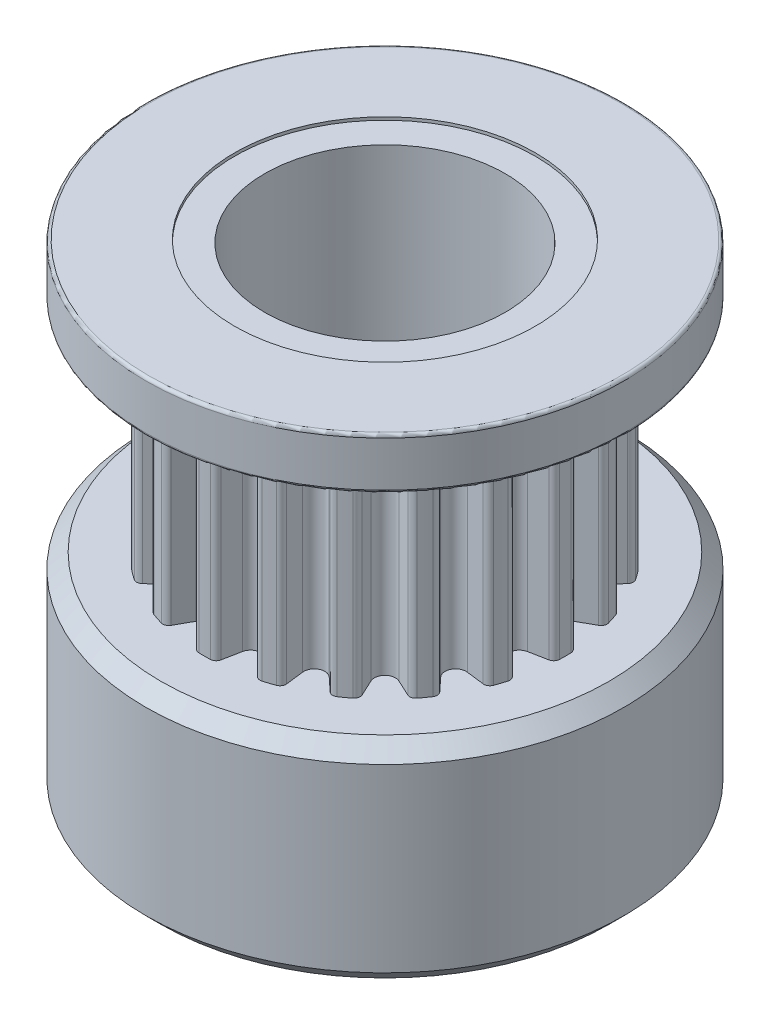
from build123d import *

# Parameters (mm, degrees)
SKETCH1_R           = 7.95
BOSS_EXTRUDE1_DEPTH = 7
BOSS_EXTRUDE2_DEPTH = 7.3
SKETCH3_R           = 7.95
BOSS_EXTRUDE3_DEPTH = 1.7
SKETCH4_R           = 4
CUT_EXTRUDE1_DEPTH  = 20.555178342
SKETCH5_R           = 5
CUT_EXTRUDE2_DEPTH  = 0.1
SKETCH6_R           = 1.65
CUT_EXTRUDE3_DEPTH  = 20.555178342
FILLET1_R           = 0.1
CHAMFER1_SIZE       = 0.5


with BuildPart() as part:
    # Sketch1 → Boss-Extrude1 (new body)
    with BuildSketch(Plane(origin=(0, 0, 0), x_dir=(1, 0, 0), z_dir=(0, 1, 0))):
        with Locations(Location((0, 0, 0), (0, 0, 270))):
            Circle(SKETCH1_R)
    extrude(amount=BOSS_EXTRUDE1_DEPTH)

    # Sketch2 → Boss-Extrude2 (add)
    with BuildSketch(Plane(origin=(0, 7, 0), x_dir=(1, 0, 0), z_dir=(0, 1, 0))):
        with BuildLine():
            Line((-0.380236117, 5.835559868), (-0.497075688, 5.239605014))
            ThreePointArc((-0.497075688, 5.239605014), (-0.785784996, 4.961251208), (-1.146379921, 5.136765327))
            Line((-1.146379921, 5.136765327), (-1.441661134, 5.667446661))
            ThreePointArc((-1.441661134, 5.667446661), (-1.540334972, 5.755161628), (-1.672167397, 5.762278733))
            ThreePointArc((-1.672167397, 5.762278733), (-1.854101966, 5.706339098), (-2.034170617, 5.644656757))
            ThreePointArc((-2.034170617, 5.644656757), (-2.136641961, 5.561409742), (-2.164913208, 5.432447817))
            Line((-2.164913208, 5.432447817), (-2.091874065, 4.829555657))
            ThreePointArc((-2.091874065, 4.829555657), (-2.280436877, 4.475609373), (-2.677619876, 4.531103259))
            Line((-2.677619876, 4.531103259), (-3.122438549, 4.944564287))
            ThreePointArc((-3.122438549, 4.944564287), (-3.24338836, 4.997494286), (-3.370967754, 4.963524594))
            ThreePointArc((-3.370967754, 4.963524594), (-3.526711514, 4.854101966), (-3.678906086, 4.739794301))
            ThreePointArc((-3.678906086, 4.739794301), (-3.750637383, 4.628956299), (-3.73767351, 4.497569923))
            Line((-3.73767351, 4.497569923), (-3.481905234, 3.946755742))
            ThreePointArc((-3.481905234, 3.946755742), (-3.551863708, 3.551863708), (-3.946755742, 3.481905234))
            Line((-3.946755742, 3.481905234), (-4.497569923, 3.73767351))
            ThreePointArc((-4.497569923, 3.73767351), (-4.628956299, 3.750637383), (-4.739794301, 3.678906086))
            ThreePointArc((-4.739794301, 3.678906086), (-4.854101966, 3.526711514), (-4.963524594, 3.370967754))
            ThreePointArc((-4.963524594, 3.370967754), (-4.997494286, 3.24338836), (-4.944564287, 3.122438549))
            Line((-4.944564287, 3.122438549), (-4.531103259, 2.677619876))
            ThreePointArc((-4.531103259, 2.677619876), (-4.475609373, 2.280436877), (-4.829555657, 2.091874065))
            Line((-4.829555657, 2.091874065), (-5.432447817, 2.164913208))
            ThreePointArc((-5.432447817, 2.164913208), (-5.561409742, 2.136641961), (-5.644656757, 2.034170617))
            ThreePointArc((-5.644656757, 2.034170617), (-5.706339098, 1.854101966), (-5.762278733, 1.672167397))
            ThreePointArc((-5.762278733, 1.672167397), (-5.755161628, 1.540334972), (-5.667446661, 1.441661134))
            Line((-5.667446661, 1.441661134), (-5.136765327, 1.146379921))
            ThreePointArc((-5.136765327, 1.146379921), (-4.961251208, 0.785784996), (-5.239605014, 0.497075688))
            Line((-5.239605014, 0.497075688), (-5.835559868, 0.380236117))
            ThreePointArc((-5.835559868, 0.380236117), (-5.949473652, 0.313497136), (-5.996980881, 0.190316355))
            ThreePointArc((-5.996980881, 0.190316355), (-6, 0), (-5.996980881, -0.190316355))
            ThreePointArc((-5.996980881, -0.190316355), (-5.949473652, -0.313497136), (-5.835559868, -0.380236117))
            Line((-5.835559868, -0.380236117), (-5.239605014, -0.497075688))
            ThreePointArc((-5.239605014, -0.497075688), (-4.961251208, -0.785784996), (-5.136765327, -1.146379921))
            Line((-5.136765327, -1.146379921), (-5.667446661, -1.441661134))
            ThreePointArc((-5.667446661, -1.441661134), (-5.755161628, -1.540334972), (-5.762278733, -1.672167397))
            ThreePointArc((-5.762278733, -1.672167397), (-5.706339098, -1.854101966), (-5.644656757, -2.034170617))
            ThreePointArc((-5.644656757, -2.034170617), (-5.561409742, -2.136641961), (-5.432447817, -2.164913208))
            Line((-5.432447817, -2.164913208), (-4.829555657, -2.091874065))
            ThreePointArc((-4.829555657, -2.091874065), (-4.475609373, -2.280436877), (-4.531103259, -2.677619876))
            Line((-4.531103259, -2.677619876), (-4.944564287, -3.122438549))
            ThreePointArc((-4.944564287, -3.122438549), (-4.997494286, -3.24338836), (-4.963524594, -3.370967754))
            ThreePointArc((-4.963524594, -3.370967754), (-4.854101966, -3.526711514), (-4.739794301, -3.678906086))
            ThreePointArc((-4.739794301, -3.678906086), (-4.628956299, -3.750637383), (-4.497569923, -3.73767351))
            Line((-4.497569923, -3.73767351), (-3.946755742, -3.481905234))
            ThreePointArc((-3.946755742, -3.481905234), (-3.551863708, -3.551863708), (-3.481905234, -3.946755742))
            Line((-3.481905234, -3.946755742), (-3.73767351, -4.497569923))
            ThreePointArc((-3.73767351, -4.497569923), (-3.750637383, -4.628956299), (-3.678906086, -4.739794301))
            ThreePointArc((-3.678906086, -4.739794301), (-3.526711514, -4.854101966), (-3.370967754, -4.963524594))
            ThreePointArc((-3.370967754, -4.963524594), (-3.24338836, -4.997494286), (-3.122438549, -4.944564287))
            Line((-3.122438549, -4.944564287), (-2.677619876, -4.531103259))
            ThreePointArc((-2.677619876, -4.531103259), (-2.280436877, -4.475609373), (-2.091874065, -4.829555657))
            Line((-2.091874065, -4.829555657), (-2.164913208, -5.432447817))
            ThreePointArc((-2.164913208, -5.432447817), (-2.136641961, -5.561409742), (-2.034170617, -5.644656757))
            ThreePointArc((-2.034170617, -5.644656757), (-1.854101966, -5.706339098), (-1.672167397, -5.762278733))
            ThreePointArc((-1.672167397, -5.762278733), (-1.540334972, -5.755161628), (-1.441661134, -5.667446661))
            Line((-1.441661134, -5.667446661), (-1.146379921, -5.136765327))
            ThreePointArc((-1.146379921, -5.136765327), (-0.785784996, -4.961251208), (-0.497075688, -5.239605014))
            Line((-0.497075688, -5.239605014), (-0.380236117, -5.835559868))
            ThreePointArc((-0.380236117, -5.835559868), (-0.313497136, -5.949473652), (-0.190316355, -5.996980881))
            ThreePointArc((-0.190316355, -5.996980881), (0, -6), (0.190316355, -5.996980881))
            ThreePointArc((0.190316355, -5.996980881), (0.313497136, -5.949473652), (0.380236117, -5.835559868))
            Line((0.380236117, -5.835559868), (0.497075688, -5.239605014))
            ThreePointArc((0.497075688, -5.239605014), (0.785784996, -4.961251208), (1.146379921, -5.136765327))
            Line((1.146379921, -5.136765327), (1.441661134, -5.667446661))
            ThreePointArc((1.441661134, -5.667446661), (1.540334972, -5.755161628), (1.672167397, -5.762278733))
            ThreePointArc((1.672167397, -5.762278733), (1.854101966, -5.706339098), (2.034170617, -5.644656757))
            ThreePointArc((2.034170617, -5.644656757), (2.136641961, -5.561409742), (2.164913208, -5.432447817))
            Line((2.164913208, -5.432447817), (2.091874065, -4.829555657))
            ThreePointArc((2.091874065, -4.829555657), (2.280436877, -4.475609373), (2.677619876, -4.531103259))
            Line((2.677619876, -4.531103259), (3.122438549, -4.944564287))
            ThreePointArc((3.122438549, -4.944564287), (3.24338836, -4.997494286), (3.370967754, -4.963524594))
            ThreePointArc((3.370967754, -4.963524594), (3.526711514, -4.854101966), (3.678906086, -4.739794301))
            ThreePointArc((3.678906086, -4.739794301), (3.750637383, -4.628956299), (3.73767351, -4.497569923))
            Line((3.73767351, -4.497569923), (3.481905234, -3.946755742))
            ThreePointArc((3.481905234, -3.946755742), (3.551863708, -3.551863708), (3.946755742, -3.481905234))
            Line((3.946755742, -3.481905234), (4.497569923, -3.73767351))
            ThreePointArc((4.497569923, -3.73767351), (4.628956299, -3.750637383), (4.739794301, -3.678906086))
            ThreePointArc((4.739794301, -3.678906086), (4.854101966, -3.526711514), (4.963524594, -3.370967754))
            ThreePointArc((4.963524594, -3.370967754), (4.997494286, -3.24338836), (4.944564287, -3.122438549))
            Line((4.944564287, -3.122438549), (4.531103259, -2.677619876))
            ThreePointArc((4.531103259, -2.677619876), (4.475609373, -2.280436877), (4.829555657, -2.091874065))
            Line((4.829555657, -2.091874065), (5.432447817, -2.164913208))
            ThreePointArc((5.432447817, -2.164913208), (5.561409742, -2.136641961), (5.644656757, -2.034170617))
            ThreePointArc((5.644656757, -2.034170617), (5.706339098, -1.854101966), (5.762278733, -1.672167397))
            ThreePointArc((5.762278733, -1.672167397), (5.755161628, -1.540334972), (5.667446661, -1.441661134))
            Line((5.667446661, -1.441661134), (5.136765327, -1.146379921))
            ThreePointArc((5.136765327, -1.146379921), (4.961251208, -0.785784996), (5.239605014, -0.497075688))
            Line((5.239605014, -0.497075688), (5.835559868, -0.380236117))
            ThreePointArc((5.835559868, -0.380236117), (5.949473652, -0.313497136), (5.996980881, -0.190316355))
            ThreePointArc((5.996980881, -0.190316355), (6, 0), (5.996980881, 0.190316355))
            ThreePointArc((5.996980881, 0.190316355), (5.949473652, 0.313497136), (5.835559868, 0.380236117))
            Line((5.835559868, 0.380236117), (5.239605014, 0.497075688))
            ThreePointArc((5.239605014, 0.497075688), (4.961251208, 0.785784996), (5.136765327, 1.146379921))
            Line((5.136765327, 1.146379921), (5.667446661, 1.441661134))
            ThreePointArc((5.667446661, 1.441661134), (5.755161628, 1.540334972), (5.762278733, 1.672167397))
            ThreePointArc((5.762278733, 1.672167397), (5.706339098, 1.854101966), (5.644656757, 2.034170617))
            ThreePointArc((5.644656757, 2.034170617), (5.561409742, 2.136641961), (5.432447817, 2.164913208))
            Line((5.432447817, 2.164913208), (4.829555657, 2.091874065))
            ThreePointArc((4.829555657, 2.091874065), (4.475609373, 2.280436877), (4.531103259, 2.677619876))
            Line((4.531103259, 2.677619876), (4.944564287, 3.122438549))
            ThreePointArc((4.944564287, 3.122438549), (4.997494286, 3.24338836), (4.963524594, 3.370967754))
            ThreePointArc((4.963524594, 3.370967754), (4.854101966, 3.526711514), (4.739794301, 3.678906086))
            ThreePointArc((4.739794301, 3.678906086), (4.628956299, 3.750637383), (4.497569923, 3.73767351))
            Line((4.497569923, 3.73767351), (3.946755742, 3.481905234))
            ThreePointArc((3.946755742, 3.481905234), (3.551863708, 3.551863708), (3.481905234, 3.946755742))
            Line((3.481905234, 3.946755742), (3.73767351, 4.497569923))
            ThreePointArc((3.73767351, 4.497569923), (3.750637383, 4.628956299), (3.678906086, 4.739794301))
            ThreePointArc((3.678906086, 4.739794301), (3.526711514, 4.854101966), (3.370967754, 4.963524594))
            ThreePointArc((3.370967754, 4.963524594), (3.24338836, 4.997494286), (3.122438549, 4.944564287))
            Line((3.122438549, 4.944564287), (2.677619876, 4.531103259))
            ThreePointArc((2.677619876, 4.531103259), (2.280436877, 4.475609373), (2.091874065, 4.829555657))
            Line((2.091874065, 4.829555657), (2.164913208, 5.432447817))
            ThreePointArc((2.164913208, 5.432447817), (2.136641961, 5.561409742), (2.034170617, 5.644656757))
            ThreePointArc((2.034170617, 5.644656757), (1.854101966, 5.706339098), (1.672167397, 5.762278733))
            ThreePointArc((1.672167397, 5.762278733), (1.540334972, 5.755161628), (1.441661134, 5.667446661))
            Line((1.441661134, 5.667446661), (1.146379921, 5.136765327))
            ThreePointArc((1.146379921, 5.136765327), (0.785784996, 4.961251208), (0.497075688, 5.239605014))
            Line((0.497075688, 5.239605014), (0.380236117, 5.835559868))
            ThreePointArc((0.380236117, 5.835559868), (0.313497136, 5.949473652), (0.190316355, 5.996980881))
            ThreePointArc((0.190316355, 5.996980881), (0, 6), (-0.190316355, 5.996980881))
            ThreePointArc((-0.190316355, 5.996980881), (-0.313497136, 5.949473652), (-0.380236117, 5.835559868))
        make_face()
    extrude(amount=BOSS_EXTRUDE2_DEPTH)

    # Sketch3 → Boss-Extrude3 (add)
    with BuildSketch(Plane(origin=(0, 14.3, 0), x_dir=(1, 0, 0), z_dir=(0, 1, 0))):
        with Locations(Location((0, 0, 0), (0, 0, 270))):
            Circle(SKETCH3_R)
    extrude(amount=BOSS_EXTRUDE3_DEPTH)

    # Sketch4 → Cut-Extrude1 (cut, through all)
    with BuildSketch(Plane(origin=(0, 16, 0), x_dir=(1, 0, 0), z_dir=(0, 1, 0))):
        with Locations(Location((0, 0, 0), (0, 0, 270))):
            Circle(SKETCH4_R)
    extrude(amount=-CUT_EXTRUDE1_DEPTH, mode=Mode.SUBTRACT)

    # Sketch5 → Cut-Extrude2 (cut)
    with BuildSketch(Plane(origin=(0, 16, 0), x_dir=(1, 0, 0), z_dir=(0, 1, 0))):
        with Locations(Location((0, 0, 0), (0, 0, 270))):
            Circle(SKETCH5_R)
    extrude(amount=-CUT_EXTRUDE2_DEPTH, mode=Mode.SUBTRACT)

    # Sketch6 → Cut-Extrude3 (cut, through all)
    with BuildSketch(Plane.XY):
        with Locations((0, 3.5)):
            Circle(SKETCH6_R)
    extrude(amount=-CUT_EXTRUDE3_DEPTH, mode=Mode.SUBTRACT)

    # Fillet1
    fillet1_edges = [part.edges().sort_by_distance(p)[0] for p in [
        (0, 14.3, -7.95),
        (0, 16, -7.95),
    ]]
    fillet(fillet1_edges, radius=FILLET1_R)

    # Chamfer1
    chamfer1_edges = [part.edges().sort_by_distance(p)[0] for p in [
        (0, 0, -7.95),
        (0, 7, -7.95),
    ]]
    chamfer(chamfer1_edges, length=CHAMFER1_SIZE)


solid = part.part
